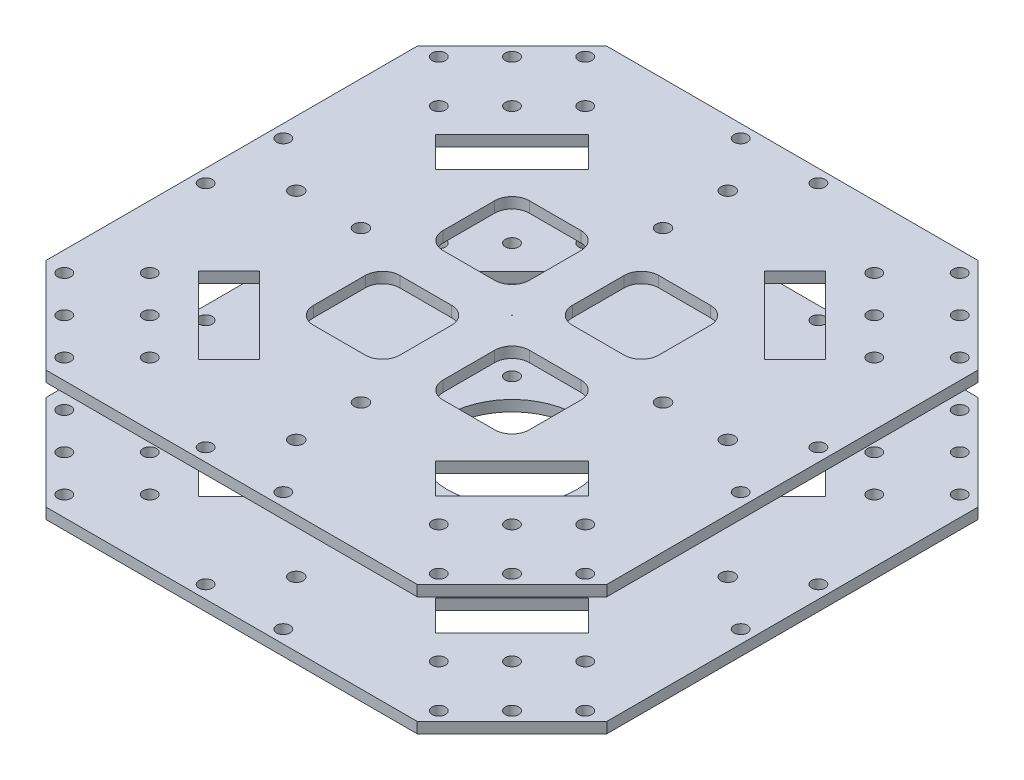
from build123d import *

# Parameters (mm, degrees)
SKETCH_1_W           = 130
SKETCH_1_H           = 130
EXTRUDE_1_DEPTH      = 2.5
SKETCH_2_W           = 130
SKETCH_2_H           = 130
EXTRUDE_2_DEPTH      = 2.5
CUT_EXTRUDE_1_DEPTH  = 250
SKETCH_5_R           = 1.55
CUT_EXTRUDE_3_DEPTH  = 250
SKETCH_6_R           = 0.05
CUT_EXTRUDE_4_DEPTH  = 10
SKETCH_7_R           = 1.55
CUT_EXTRUDE_5_DEPTH  = 50
SKETCH_8_W           = 20
SKETCH_8_H           = 20
CUT_EXTRUDE_6_DEPTH  = 10
FILLET_1_R           = 4
SKETCH_9_R           = 1.55
CUT_EXTRUDE_7_DEPTH  = 10
SKETCH_11_R          = 15
CUT_EXTRUDE_8_DEPTH  = 10
CUT_EXTRUDE_9_DEPTH  = 40
SKETCH_12_R          = 1.6
CUT_EXTRUDE_10_DEPTH = 50


with BuildPart() as part:
    # 草图1 → 凸台-拉伸1 (new body)
    with BuildSketch(Plane(origin=(0, 0, 0), x_dir=(1, 0, 0), z_dir=(0, 1, 0))):
        Rectangle(SKETCH_1_W, SKETCH_1_H)
    extrude(amount=EXTRUDE_1_DEPTH)


with BuildPart() as body_2:
    # 草图2 → 凸台-拉伸2 (new body)
    with BuildSketch(Plane(origin=(0, 27.5, 0), x_dir=(1, 0, 0), z_dir=(0, 1, 0))):
        Rectangle(SKETCH_2_W, SKETCH_2_H)
    extrude(amount=EXTRUDE_2_DEPTH)


with BuildPart() as cut_extrude_1_tool:
    # 草图3 → 切除-拉伸1 (new, symmetric)
    with BuildSketch(Plane(origin=(0, 0, 0), x_dir=(1, 0, 0), z_dir=(0, 1, 0))):
        Polygon((-43, 65), (-65, 43), (-65, 65), align=None)
        Polygon((65, 65), (43, 65), (65, 43), align=None)
        Polygon((43, -65), (65, -43), (65, -65), align=None)
        Polygon((-65, -65), (-43, -65), (-65, -43), align=None)
    extrude(amount=CUT_EXTRUDE_1_DEPTH, both=True)


with BuildPart() as part_1:
    add(part.part)

    # 切除-拉伸1: cut by cut_extrude_1_tool
    add(cut_extrude_1_tool.part, mode=Mode.SUBTRACT)


with BuildPart() as body_2_1:
    add(body_2.part)

    # 切除-拉伸1: cut by cut_extrude_1_tool
    add(cut_extrude_1_tool.part, mode=Mode.SUBTRACT)


with BuildPart() as cut_extrude_3_tool:
    # 草图5 → 切除-拉伸3 (new, symmetric)
    with BuildSketch(Plane(origin=(0, 30, 0), x_dir=(1, 0, 0), z_dir=(0, 1, 0))):
        with Locations((-60.363961031, 43.393398282)):
            Circle(SKETCH_5_R)
        with Locations((-43.393398282, 60.363961031)):
            Circle(SKETCH_5_R)
        with Locations((43.393398282, 60.363961031)):
            Circle(SKETCH_5_R)
        with Locations((60.363961031, 43.393398282)):
            Circle(SKETCH_5_R)
        with Locations((60.363961031, -43.393398282)):
            Circle(SKETCH_5_R)
        with Locations((43.393398282, -60.363961031)):
            Circle(SKETCH_5_R)
        with Locations((-43.393398282, -60.363961031)):
            Circle(SKETCH_5_R)
        with Locations((-60.363961031, -43.393398282)):
            Circle(SKETCH_5_R)
        with Locations((-50.464466094, 33.493903346)):
            Circle(SKETCH_5_R)
        with Locations((-33.493903346, 50.464466094)):
            Circle(SKETCH_5_R)
        with Locations((33.493903346, 50.464466094)):
            Circle(SKETCH_5_R)
        with Locations((50.464466094, 33.493903346)):
            Circle(SKETCH_5_R)
        with Locations((33.493903346, -50.464466094)):
            Circle(SKETCH_5_R)
        with Locations((50.464466094, -33.493903346)):
            Circle(SKETCH_5_R)
        with Locations((-33.493903346, -50.464466094)):
            Circle(SKETCH_5_R)
        with Locations((-50.464466094, -33.493903346)):
            Circle(SKETCH_5_R)
        with Locations((-51.878679656, 51.878679656)):
            Circle(SKETCH_5_R)
        with Locations((-41.97918472, 41.97918472)):
            Circle(SKETCH_5_R)
        with Locations((41.97918472, 41.97918472)):
            Circle(SKETCH_5_R)
        with Locations((51.878679656, 51.878679656)):
            Circle(SKETCH_5_R)
        with Locations((51.878679656, -51.878679656)):
            Circle(SKETCH_5_R)
        with Locations((41.97918472, -41.97918472)):
            Circle(SKETCH_5_R)
        with Locations((-41.97918472, -41.97918472)):
            Circle(SKETCH_5_R)
        with Locations((-51.878679656, -51.878679656)):
            Circle(SKETCH_5_R)
    extrude(amount=CUT_EXTRUDE_3_DEPTH, both=True)


with BuildPart() as part_2:
    add(part_1.part)

    # 切除-拉伸3: cut by cut_extrude_3_tool
    add(cut_extrude_3_tool.part, mode=Mode.SUBTRACT)


with BuildPart() as body_2_2:
    add(body_2_1.part)

    # 切除-拉伸3: cut by cut_extrude_3_tool
    add(cut_extrude_3_tool.part, mode=Mode.SUBTRACT)

    # 草图6 → 切除-拉伸4 (cut)
    with BuildSketch(Plane(origin=(0, 30, 0), x_dir=(1, 0, 0), z_dir=(0, 1, 0))):
        Circle(SKETCH_6_R)
    extrude(amount=-CUT_EXTRUDE_4_DEPTH, mode=Mode.SUBTRACT)


with BuildPart() as cut_extrude_5_tool:
    # 草图7 → 切除-拉伸5 (new body)
    with BuildSketch(Plane(origin=(0, 30, 0), x_dir=(1, 0, 0), z_dir=(0, 1, 0))):
        with Locations((-62, 9)):
            Circle(SKETCH_7_R)
        with Locations((-62, -9)):
            Circle(SKETCH_7_R)
        with Locations((62, -9)):
            Circle(SKETCH_7_R)
        with Locations((62, 9)):
            Circle(SKETCH_7_R)
        with Locations((-9, -62)):
            Circle(SKETCH_7_R)
        with Locations((9, -62)):
            Circle(SKETCH_7_R)
        with Locations((9, 62)):
            Circle(SKETCH_7_R)
        with Locations((-9, 62)):
            Circle(SKETCH_7_R)
    extrude(amount=-CUT_EXTRUDE_5_DEPTH)


with BuildPart() as part_3:
    add(part_2.part)

    # 切除-拉伸5: cut by cut_extrude_5_tool
    add(cut_extrude_5_tool.part, mode=Mode.SUBTRACT)

    # 草图9 → 切除-拉伸7 (cut)
    with BuildSketch(Plane.XZ):
        with Locations((-26, 22.65)):
            Circle(SKETCH_9_R)
        with Locations((26, 22.65)):
            Circle(SKETCH_9_R)
        with Locations((26, -22.65)):
            Circle(SKETCH_9_R)
        with Locations((-26, -22.65)):
            Circle(SKETCH_9_R)
        with Locations((-15.25, 15.25)):
            Circle(SKETCH_9_R)
        with Locations((15.25, 15.25)):
            Circle(SKETCH_9_R)
        with Locations((-15.25, -15.25)):
            Circle(SKETCH_9_R)
        with Locations((15.25, -15.25)):
            Circle(SKETCH_9_R)
    extrude(amount=-CUT_EXTRUDE_7_DEPTH, mode=Mode.SUBTRACT)

    # 草图11 → 切除-拉伸8 (cut)
    with BuildSketch(Plane.XZ):
        Circle(SKETCH_11_R)
    extrude(amount=-CUT_EXTRUDE_8_DEPTH, mode=Mode.SUBTRACT)


with BuildPart() as body_2_3:
    add(body_2_2.part)

    # 切除-拉伸5: cut by cut_extrude_5_tool
    add(cut_extrude_5_tool.part, mode=Mode.SUBTRACT)

    # 草图8 → 切除-拉伸6 (cut)
    with BuildSketch(Plane(origin=(0, 30, 0), x_dir=(1, 0, 0), z_dir=(0, 1, 0))):
        with Locations((15, -15)):
            Rectangle(SKETCH_8_W, SKETCH_8_H)
        with Locations((-15, -15)):
            Rectangle(SKETCH_8_W, SKETCH_8_H)
        with Locations((15, 15)):
            Rectangle(SKETCH_8_W, SKETCH_8_H)
        with Locations((-15, 15)):
            Rectangle(SKETCH_8_W, SKETCH_8_H)
    extrude(amount=-CUT_EXTRUDE_6_DEPTH, mode=Mode.SUBTRACT)

    # 圆角1
    fillet_1_edges = [body_2_3.edges().sort_by_distance(p)[0] for p in [
        (-25, 28.75, 25),
        (25, 28.75, 25),
        (25, 28.75, -25),
        (-25, 28.75, -25),
        (25, 28.75, 5),
        (5, 28.75, 25),
        (5, 28.75, 5),
        (-5, 28.75, 25),
        (-25, 28.75, 5),
        (-5, 28.75, 5),
        (25, 28.75, -5),
        (5, 28.75, -5),
        (-5, 28.75, -5),
        (-25, 28.75, -5),
        (5, 28.75, -25),
        (-5, 28.75, -25),
    ]]
    fillet(fillet_1_edges, radius=FILLET_1_R)


with BuildPart() as cut_extrude_9_tool:
    # 草图11<3> → 切除-拉伸9 (new body)
    with BuildSketch(Plane.XZ):
        Polygon((-27.483495706, 45.161165235), (-45.161165235, 27.483495706), (-38.090097423, 20.412427894), (-20.412427894, 38.090097423), align=None)
        Polygon((20.412427894, 38.090097423), (38.090097423, 20.412427894), (45.161165235, 27.483495706), (27.483495706, 45.161165235), align=None)
        Polygon((27.483495706, -45.161165235), (45.161165235, -27.483495706), (38.090097423, -20.412427894), (20.412427894, -38.090097423), align=None)
        Polygon((-20.412427894, -38.090097423), (-38.090097423, -20.412427894), (-45.161165235, -27.483495706), (-27.483495706, -45.161165235), align=None)
    extrude(amount=-CUT_EXTRUDE_9_DEPTH)


with BuildPart() as part_4:
    add(part_3.part)

    # 切除-拉伸9: cut by cut_extrude_9_tool
    add(cut_extrude_9_tool.part, mode=Mode.SUBTRACT)


with BuildPart() as body_2_4:
    add(body_2_3.part)

    # 切除-拉伸9: cut by cut_extrude_9_tool
    add(cut_extrude_9_tool.part, mode=Mode.SUBTRACT)


with BuildPart() as cut_extrude_10_tool:
    # 草图12 → 切除-拉伸10 (new body)
    with BuildSketch(Plane.XZ):
        with Locations((0, 50)):
            Circle(SKETCH_12_R)
        with Locations((0, 35)):
            Circle(SKETCH_12_R)
        with Locations((0, -35)):
            Circle(SKETCH_12_R)
        with Locations((0, -50)):
            Circle(SKETCH_12_R)
        with Locations((-50, 0)):
            Circle(SKETCH_12_R)
        with Locations((-35, 0)):
            Circle(SKETCH_12_R)
        with Locations((35, 0)):
            Circle(SKETCH_12_R)
        with Locations((50, 0)):
            Circle(SKETCH_12_R)
    extrude(amount=-CUT_EXTRUDE_10_DEPTH)


with BuildPart() as part_5:
    add(part_4.part)

    # 切除-拉伸10: cut by cut_extrude_10_tool
    add(cut_extrude_10_tool.part, mode=Mode.SUBTRACT)


with BuildPart() as body_2_5:
    add(body_2_4.part)

    # 切除-拉伸10: cut by cut_extrude_10_tool
    add(cut_extrude_10_tool.part, mode=Mode.SUBTRACT)


solid = Compound([part_5.part, body_2_5.part])
